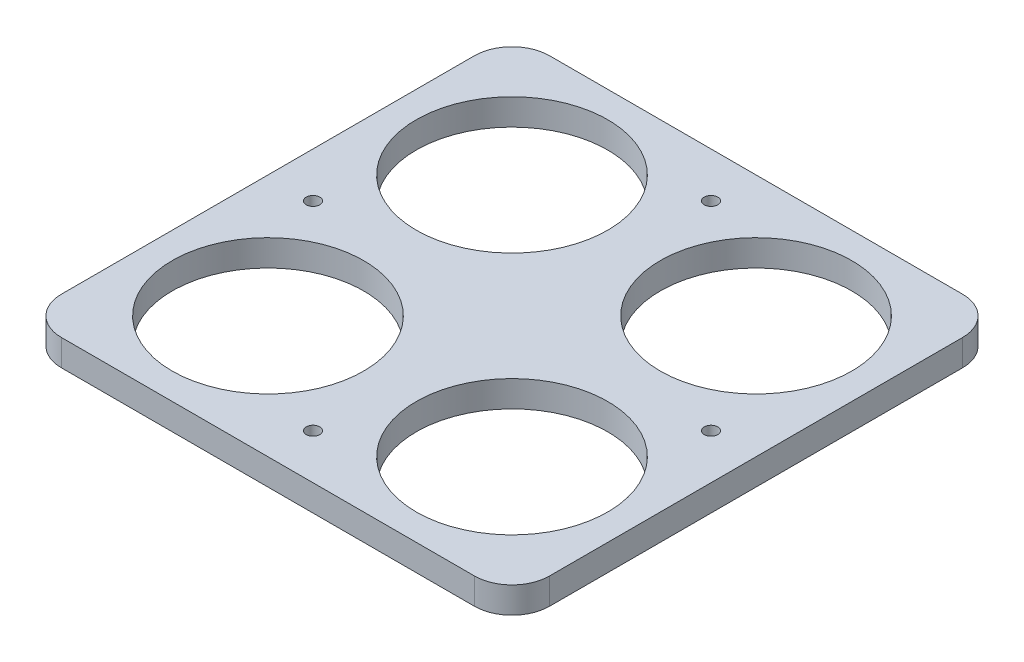
from build123d import *

# Parameters (mm, degrees)
SKETCH1_W           = 130
SKETCH1_H           = 130
SKETCH1_R           = 25.5
SKETCH1_R_2         = 1.8
BOSS_EXTRUDE1_DEPTH = 7
FILLET1_R           = 10


with BuildPart() as part:
    # Sketch1 → Boss-Extrude1 (new body)
    with BuildSketch(Plane(origin=(0, 0, 0), x_dir=(1, 0, 0), z_dir=(0, 1, 0))):
        Rectangle(SKETCH1_W, SKETCH1_H)
        with Locations(Location((-32.5, 32.5, 0), (0, 0, 270))):
            Circle(SKETCH1_R, mode=Mode.SUBTRACT)
        with Locations(Location((32.5, 32.5, 0), (0, 0, 270))):
            Circle(SKETCH1_R, mode=Mode.SUBTRACT)
        with Locations(Location((-32.5, -32.5, 0), (0, 0, 270))):
            Circle(SKETCH1_R, mode=Mode.SUBTRACT)
        with Locations(Location((32.5, -32.5, 0), (0, 0, 270))):
            Circle(SKETCH1_R, mode=Mode.SUBTRACT)
        with Locations(Location((0, -53, 0), (0, 0, 270))):
            Circle(SKETCH1_R_2, mode=Mode.SUBTRACT)
        with Locations(Location((-53, 0, 0), (0, 0, 270))):
            Circle(SKETCH1_R_2, mode=Mode.SUBTRACT)
        with Locations(Location((0, 53, 0), (0, 0, 90))):
            Circle(SKETCH1_R_2, mode=Mode.SUBTRACT)
        with Locations(Location((53, 0, 0), (0, 0, 90))):
            Circle(SKETCH1_R_2, mode=Mode.SUBTRACT)
    extrude(amount=BOSS_EXTRUDE1_DEPTH)

    # Fillet1
    fillet1_edges = [part.edges().sort_by_distance(p)[0] for p in [
        (-65, 3.5, -65),
        (65, 3.5, -65),
        (65, 3.5, 65),
        (-65, 3.5, 65),
    ]]
    fillet(fillet1_edges, radius=FILLET1_R)


solid = part.part
